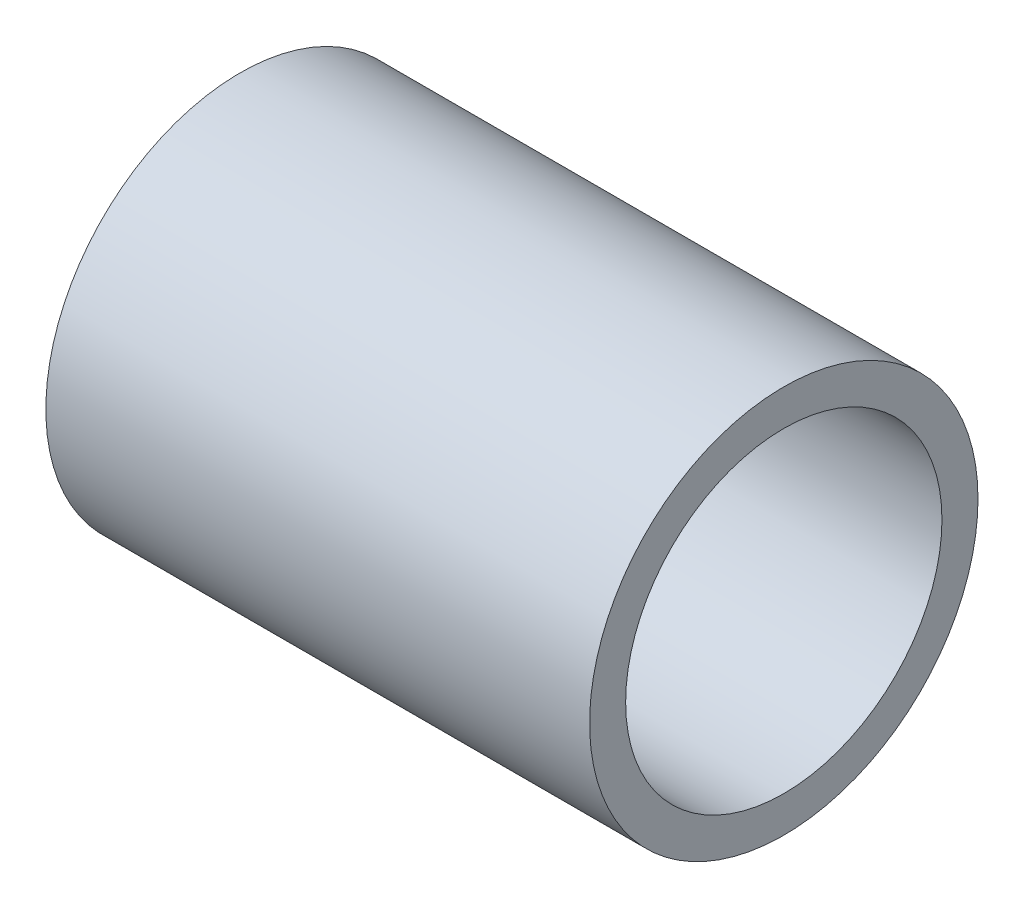
from build123d import *

# Parameters (mm, degrees)
SKETCH1_R           = 7.9375
SKETCH1_R_2         = 6.4643
BOSS_EXTRUDE1_DEPTH = 22.225


with BuildPart() as part:
    # Sketch1 → Boss-Extrude1 (new body)
    with BuildSketch(Plane(origin=(0, 0, 0), x_dir=(0, 0, -1), z_dir=(1, 0, 0))):
        Circle(SKETCH1_R)
        Circle(SKETCH1_R_2, mode=Mode.SUBTRACT)
    extrude(amount=BOSS_EXTRUDE1_DEPTH)


solid = part.part
